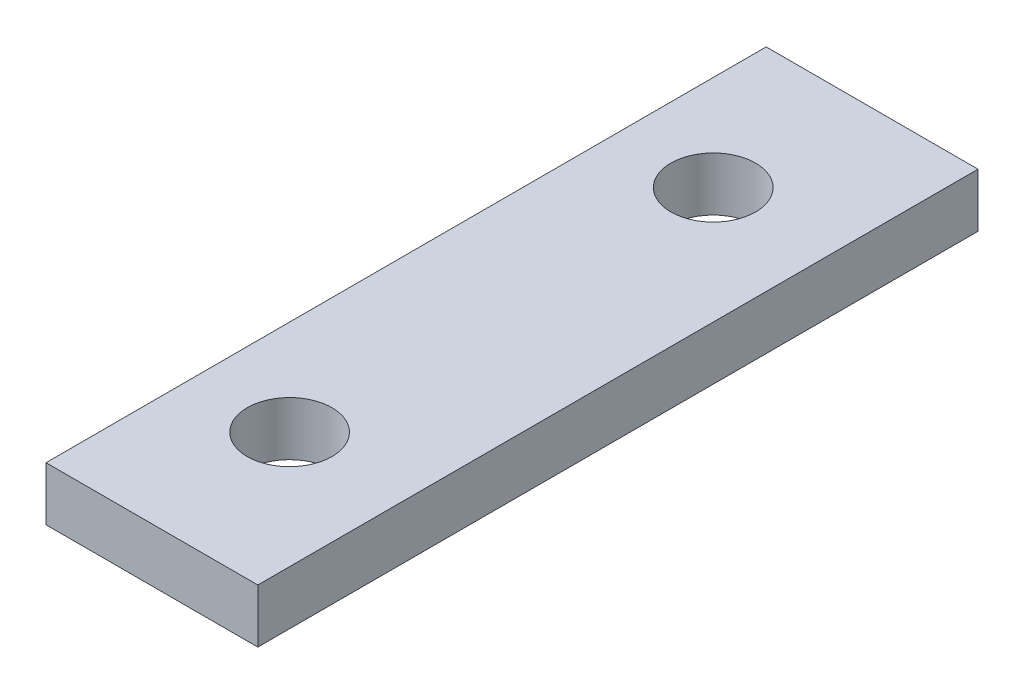
from build123d import *

# Parameters (mm, degrees)
CROQUIS1_W              = 50
CROQUIS1_H              = 170
CROQUIS1_R              = 10
SALIENTE_EXTRUIR1_DEPTH = 12.7


with BuildPart() as part:
    # Croquis1 → Saliente-Extruir1 (new body)
    with BuildSketch(Plane(origin=(0, 0, 0), x_dir=(1, 0, 0), z_dir=(0, 1, 0))):
        Rectangle(CROQUIS1_W, CROQUIS1_H)
        with Locations(Location((-2.5, 50, 0), (0, 0, 270))):
            Circle(CROQUIS1_R, mode=Mode.SUBTRACT)
        with Locations(Location((-2.5, -50, 0), (0, 0, 270))):
            Circle(CROQUIS1_R, mode=Mode.SUBTRACT)
    extrude(amount=SALIENTE_EXTRUIR1_DEPTH)


solid = part.part
